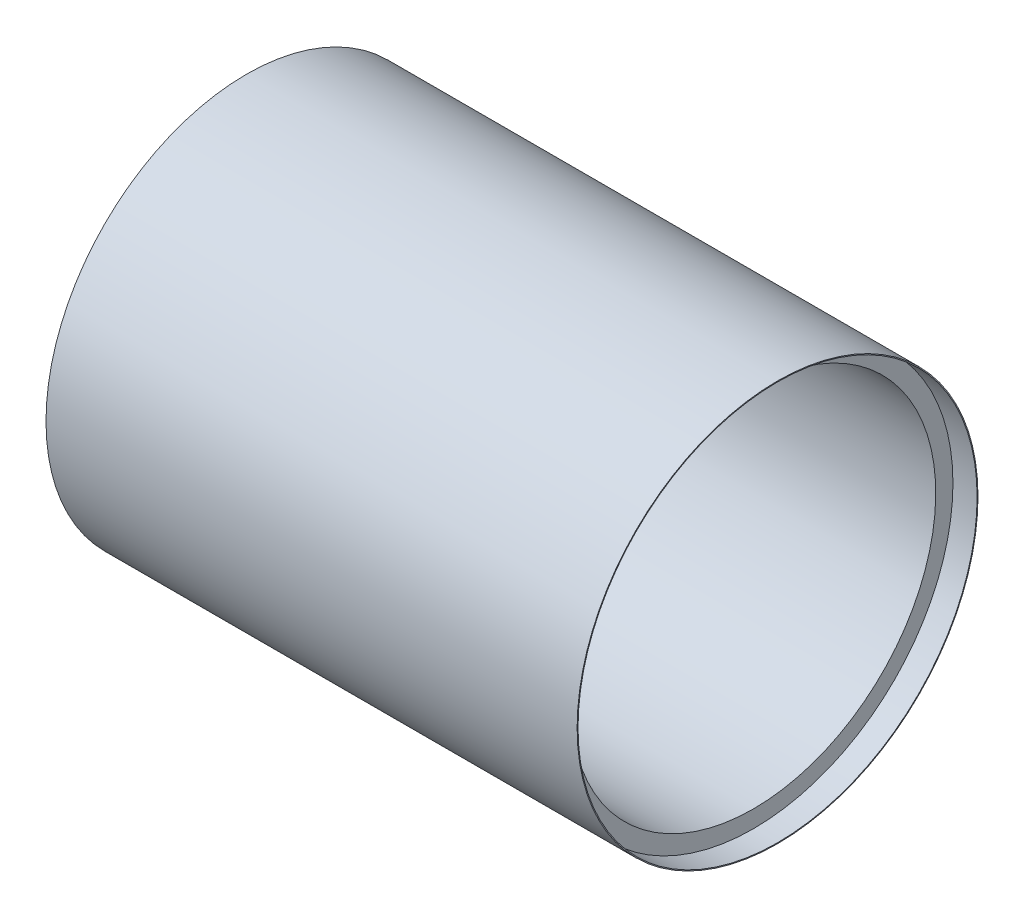
from build123d import *


with BuildPart() as part:
    # Sketch1 → Revolve1 (revolve)
    with BuildSketch(Plane.XY, mode=Mode.PRIVATE) as revolve1_sk:
        Polygon((39.146309032, 83.9724), (49.306309032, 83.9724), (49.306309032, 76.7334), (252.506309032, 76.7334), (252.506309032, 83.9724), (262.666309032, 83.9724), (262.666309032, 84.3534), (39.146309032, 84.3534), align=None)
    revolve(revolve1_sk.sketch.rotate(Axis((0, 0, 0), (1, 0, 0)), 180), axis=Axis((0, 0, 0), (1, 0, 0)))


solid = part.part
